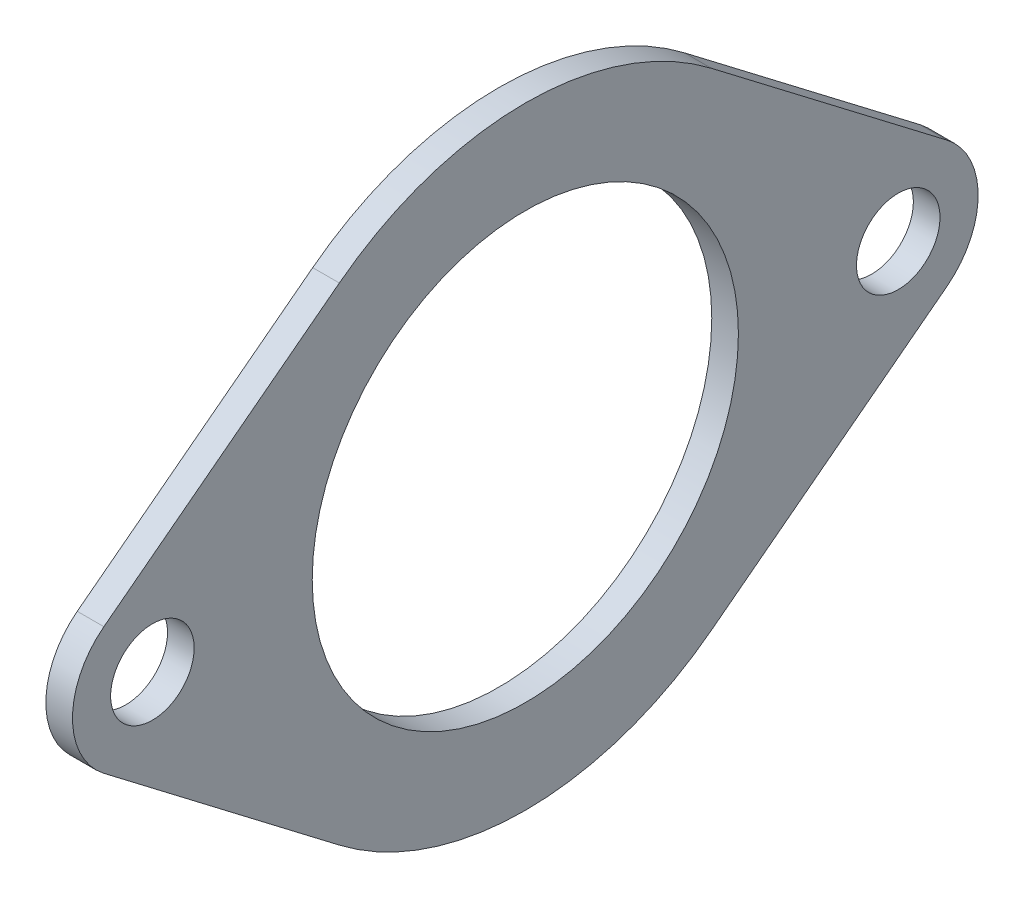
from build123d import *

# Parameters (mm, degrees)
SKETCH1_R           = 12.7
SKETCH1_R_2         = 2.4892
BOSS_EXTRUDE1_DEPTH = 0.79375


with BuildPart() as part:
    # Sketch1 → Boss-Extrude1 (new, symmetric)
    with BuildSketch(Plane(origin=(0, 0, 0), x_dir=(0, 0, -1), z_dir=(1, 0, 0))):
        with BuildLine():
            Line((-25.116517857, -3.78424771), (-11.084151786, -14.506282889))
            ThreePointArc((-11.084151786, -14.506282889), (0, -18.25625), (11.084151786, -14.506282889))
            Line((11.084151786, -14.506282889), (25.116517857, -3.78424771))
            ThreePointArc((25.116517857, -3.78424771), (26.9875, 0), (25.116517857, 3.78424771))
            Line((25.116517857, 3.78424771), (11.084151786, 14.506282889))
            ThreePointArc((11.084151786, 14.506282889), (0, 18.25625), (-11.084151786, 14.506282889))
            Line((-11.084151786, 14.506282889), (-25.116517857, 3.78424771))
            ThreePointArc((-25.116517857, 3.78424771), (-26.9875, 0), (-25.116517857, -3.78424771))
        make_face()
        Circle(SKETCH1_R, mode=Mode.SUBTRACT)
        with Locations((22.225, 0)):
            Circle(SKETCH1_R_2, mode=Mode.SUBTRACT)
        with Locations((-22.225, 0)):
            Circle(SKETCH1_R_2, mode=Mode.SUBTRACT)
    extrude(amount=BOSS_EXTRUDE1_DEPTH, both=True)


solid = part.part
